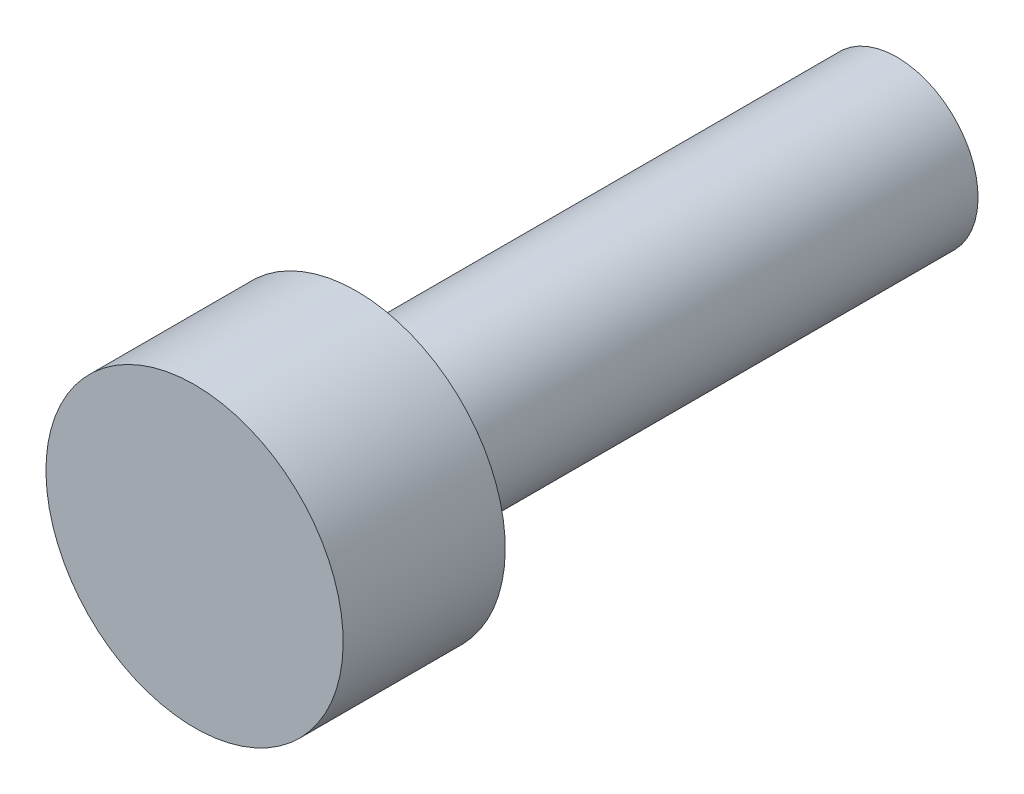
from build123d import *


with BuildPart() as part:
    # Sketch1 → Revolve1 (revolve)
    with BuildSketch(Plane(origin=(0, 0, 0), x_dir=(0, 0, -1), z_dir=(1, 0, 0))):
        Polygon((0, 0), (0, 2.75), (3, 2.75), (3, 1.5), (13, 1.5), (13, 0), align=None)
    revolve(axis=Axis((0, 0, -13), (0, 0, 1)))


solid = part.part
